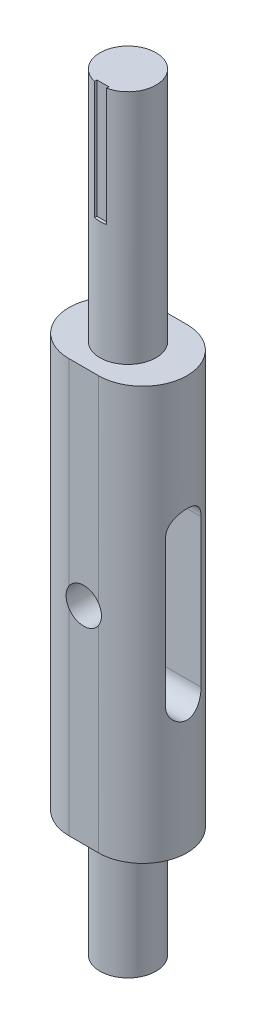
from build123d import *

# Parameters (mm, degrees)
ESTRUSIONE_ESTRUSIONE1_DEPTH  = 260
SCHIZZO2_R                    = 9.5
TAGLIO_ESTRUSIONE1_DEPTH      = 40
TAGLIO_ESTRUSIONE2_START      = -80
SCHIZZO3_R                    = 9.5
TAGLIO_ESTRUSIONE2_DEPTH      = 80
TAGLIO_ESTRUSIONE3_DEPTH      = 263.488094968
TAGLIO_ESTRUSIONE3_DEPTH_BACK = 263.488094968
SCHIZZO5_R                    = 6
TAGLIO_ESTRUSIONE4_DEPTH      = 80
TAGLIO_ESTRUSIONE5_START      = -40
TAGLIO_ESTRUSIONE5_DEPTH      = 40


with BuildPart() as part:
    # Schizzo1 → Estrusione-Estrusione1 (new body)
    with BuildSketch(Plane(origin=(0, 0, 0), x_dir=(1, 0, 0), z_dir=(0, 1, 0))):
        with BuildLine():
            Line((-5, 15), (5, 15))
            ThreePointArc((5, 15), (20, 0), (5, -15))
            Line((5, -15), (-5, -15))
            ThreePointArc((-5, -15), (-20, 0), (-5, 15))
        make_face()
    extrude(amount=ESTRUSIONE_ESTRUSIONE1_DEPTH)

    # Schizzo2 → Taglio-Estrusione1 (cut)
    with BuildSketch(Plane.XZ):
        with BuildLine():
            Line((-5, -15), (5, -15))
            ThreePointArc((5, -15), (20, 0), (5, 15))
            Line((5, 15), (-5, 15))
            ThreePointArc((-5, 15), (-20, 0), (-5, -15))
        make_face()
        with Locations(Location((0, 0, 0), (0, 0, 270))):
            Circle(SCHIZZO2_R, mode=Mode.SUBTRACT)
    extrude(amount=-TAGLIO_ESTRUSIONE1_DEPTH, mode=Mode.SUBTRACT)

    # Schizzo3 → Taglio-Estrusione2 (cut)
    with BuildSketch(Plane(origin=(0, 260, 0), x_dir=(1, 0, 0), z_dir=(0, 1, 0)).offset(TAGLIO_ESTRUSIONE2_START)):
        with BuildLine():
            Line((-5, -15), (5, -15))
            ThreePointArc((5, -15), (20, 0), (5, 15))
            Line((5, 15), (-5, 15))
            ThreePointArc((-5, 15), (-20, 0), (-5, -15))
        make_face()
        with Locations(Location((0, 0, 0), (0, 0, 90))):
            Circle(SCHIZZO3_R, mode=Mode.SUBTRACT)
    extrude(amount=TAGLIO_ESTRUSIONE2_DEPTH, mode=Mode.SUBTRACT)

    # Schizzo4 → Taglio-Estrusione3 (cut, two sides: drawn at the far end of the back side and taken through both)
    with BuildSketch(Plane(origin=(0, 0, 15), x_dir=(0, 0, 1), z_dir=(-1, 0, 0)).offset(-TAGLIO_ESTRUSIONE3_DEPTH_BACK)):
        with BuildLine():
            Line((-9, 135), (-9, 85))
            ThreePointArc((-9, 85), (-15, 79), (-21, 85))
            Line((-21, 85), (-21, 135))
            ThreePointArc((-21, 135), (-15, 141), (-9, 135))
        make_face()
    extrude(amount=TAGLIO_ESTRUSIONE3_DEPTH + TAGLIO_ESTRUSIONE3_DEPTH_BACK, mode=Mode.SUBTRACT)

    # Schizzo5 → Taglio-Estrusione4 (cut)
    with BuildSketch(Plane(origin=(0, 0, -15), x_dir=(-1, 0, 0), z_dir=(0, 0, -1))):
        with Locations(Location((0, 110, 0), (0, 0, 326.442690238))):
            Circle(SCHIZZO5_R)
    extrude(amount=-TAGLIO_ESTRUSIONE4_DEPTH, mode=Mode.SUBTRACT)

    # Schizzo6 → Taglio-Estrusione5 (cut)
    with BuildSketch(Plane(origin=(0, 260, 0), x_dir=(1, 0, 0), z_dir=(0, 1, 0)).offset(TAGLIO_ESTRUSIONE5_START)):
        with BuildLine():
            Line((-2, -9.287087811), (-2, -8.5))
            Line((-2, -8.5), (2, -8.5))
            Line((2, -8.5), (2, -9.287087811))
            ThreePointArc((2, -9.287087811), (0, -9.5), (-2, -9.287087811))
        make_face()
    extrude(amount=TAGLIO_ESTRUSIONE5_DEPTH, mode=Mode.SUBTRACT)


solid = part.part
